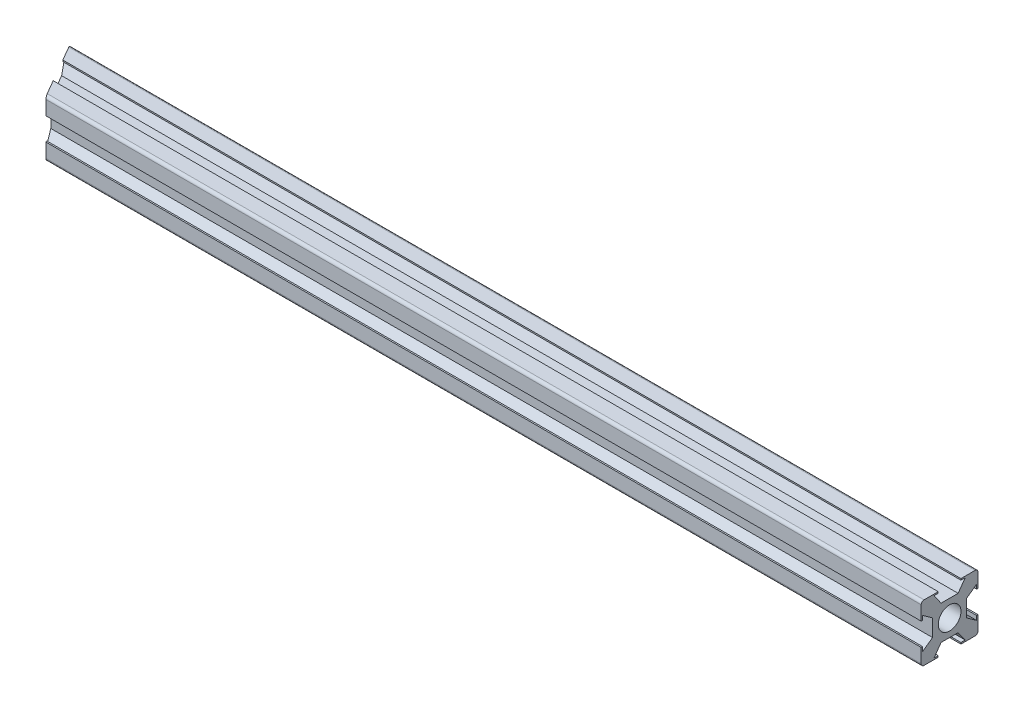
from build123d import *

# Parameters (mm, degrees)
SKETCH_1_W                       = 320
SKETCH_1_H                       = 10
EXTRUDE_1_DEPTH                  = 10
SKETCH_2_R                       = 4
CUT_EXTRUDE_1_DEPTH              = 1270
CUT_EXTRUDE_2_DEPTH              = 1270
FILLET_1_R                       = 1
PATTERN_CIRCULAR_2_COUNT         = 4
FILLET_1_OF_PATTERN_CIRCULAR_2_R = 1
CUT_EXTRUDE_4_DEPTH              = 24


with BuildPart() as part:
    # 草图1 → 凸台-拉伸1 (new body)
    with BuildSketch(Plane.XY):
        with Locations((93.481285353, -6.397869645)):
            Rectangle(SKETCH_1_W, SKETCH_1_H)
    extrude_1 = extrude(amount=EXTRUDE_1_DEPTH)

    # 草图2 → 切除-拉伸1 (cut)
    with BuildSketch(Plane(origin=(253.481285353, 0, 0), x_dir=(0, 0, -1), z_dir=(1, 0, 0))):
        with Locations((0, -11.397869645)):
            Circle(SKETCH_2_R)
    cut_extrude_1 = extrude(amount=-CUT_EXTRUDE_1_DEPTH, mode=Mode.SUBTRACT)

    # 草图3 → 切除-拉伸2 (cut)
    with BuildSketch(Plane(origin=(253.481285353, 0, 0), x_dir=(0, 0, -1), z_dir=(1, 0, 0))):
        Polygon((-4, -1.397869645), (0, -1.397869645), (0, -5.397869645), (-3, -5.397869645), (-5.5, -1.897869645), (-4, -1.897869645), align=None)
        Polygon((-10, -7.397869645), (-10, -11.397869645), (-6, -11.397869645), (-6, -8.397869645), (-9.5, -5.897869645), (-9.5, -7.397869645), align=None)
    cut_extrude_2 = extrude(amount=-CUT_EXTRUDE_2_DEPTH, mode=Mode.SUBTRACT)

    # 圆角1
    fillet_1_edges = [part.edges().sort_by_distance(p)[0] for p in [
        (93.481285353, -1.397869645, 10),
    ]]
    fillet(fillet_1_edges, radius=FILLET_1_R)

    # 阵列(圆周)2: 凸台-拉伸1, 切除-拉伸1, 切除-拉伸2 ×4 about axis
    pattern_circular_2_axis = Axis((0, -11.397869645, 0), (1, 0, 0))
    add([extrude_1.rotate(pattern_circular_2_axis, i * 360 / PATTERN_CIRCULAR_2_COUNT) for i in range(1, PATTERN_CIRCULAR_2_COUNT)])
    add([cut_extrude_1.rotate(pattern_circular_2_axis, i * 360 / PATTERN_CIRCULAR_2_COUNT) for i in range(1, PATTERN_CIRCULAR_2_COUNT)], mode=Mode.SUBTRACT)
    add([cut_extrude_2.rotate(pattern_circular_2_axis, i * 360 / PATTERN_CIRCULAR_2_COUNT) for i in range(1, PATTERN_CIRCULAR_2_COUNT)], mode=Mode.SUBTRACT)

    # 圆角1 of 阵列(圆周)2
    fillet_1_of_pattern_circular_2_edges = [part.edges().sort_by_distance(p)[0] for p in [
        (93.481285353, -21.397869645, 10),
        (93.481285353, -21.397869645, -10),
        (93.481285353, -1.397869645, -10),
    ]]
    fillet(fillet_1_of_pattern_circular_2_edges, radius=FILLET_1_OF_PATTERN_CIRCULAR_2_R)

    # 草图5 → 切除-拉伸4 (cut)
    with BuildSketch(Plane.XZ.offset(21.397869645)):
        Polygon((-78.202673037, 13.081723415), (-42.997967066, 30.32515978), (-66.48214009, -10.35062107), align=None)
    extrude(amount=-CUT_EXTRUDE_4_DEPTH, mode=Mode.SUBTRACT)


solid = part.part
